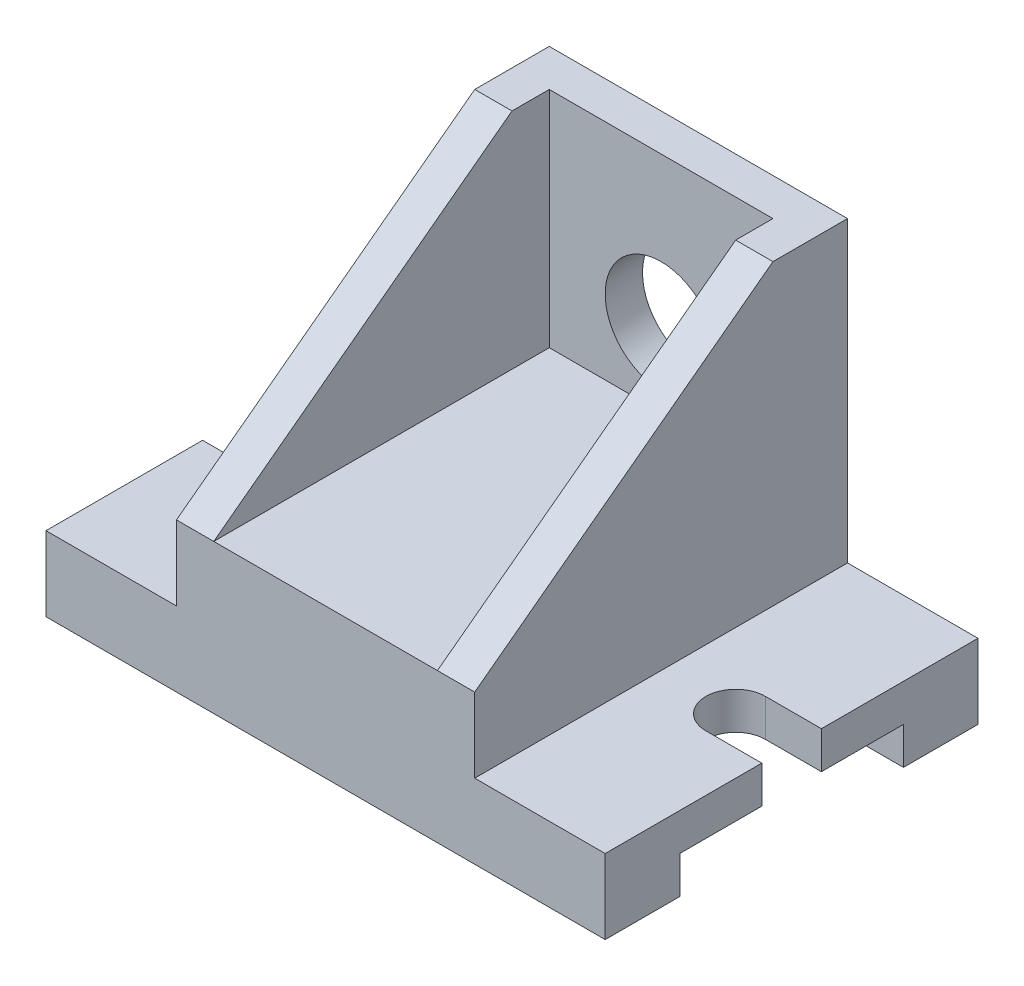
from build123d import *

# Parameters (mm, degrees)
BOSS_EXTRUDE1_DEPTH = 20
SKETCH2_W           = 60
SKETCH2_H           = 10
CUT_EXTRUDE1_DEPTH  = 182.383571472
SKETCH3_W           = 80
SKETCH3_H           = 100
BOSS_EXTRUDE2_DEPTH = 20
BOSS_EXTRUDE4_DEPTH = 60
CUT_EXTRUDE5_DEPTH  = 189.745860882
SKETCH12_R          = 15
CUT_EXTRUDE6_DEPTH  = 198.230829233
SKETCH13_W          = 60
SKETCH13_H          = 60
CUT_EXTRUDE7_DEPTH  = 10


with BuildPart() as part:
    # Sketch1 → Boss-Extrude1 (new body)
    with BuildSketch(Plane(origin=(0, 0, 0), x_dir=(1, 0, 0), z_dir=(0, 1, 0))):
        with BuildLine():
            Line((135, 58), (150, 58))
            Line((150, 58), (150, 100))
            Line((150, 100), (0, 100))
            Line((0, 100), (0, 58))
            Line((0, 58), (15, 58))
            ThreePointArc((15, 58), (23, 50), (15, 42))
            Line((15, 42), (0, 42))
            Line((0, 42), (0, 0))
            Line((0, 0), (150, 0))
            Line((150, 0), (150, 42))
            Line((150, 42), (135, 42))
            ThreePointArc((135, 42), (127, 50), (135, 58))
        make_face()
    extrude(amount=BOSS_EXTRUDE1_DEPTH)

    # Sketch2 → Cut-Extrude1 (cut, through all)
    with BuildSketch(Plane(origin=(150, 0, 0), x_dir=(0, 0, -1), z_dir=(1, 0, 0))):
        with Locations((50, 5)):
            Rectangle(SKETCH2_W, SKETCH2_H)
    extrude(amount=-CUT_EXTRUDE1_DEPTH, mode=Mode.SUBTRACT)

    # Sketch3 → Boss-Extrude2 (add)
    with BuildSketch(Plane(origin=(0, 20, 0), x_dir=(1, 0, 0), z_dir=(0, 1, 0))):
        with Locations((75, 50)):
            Rectangle(SKETCH3_W, SKETCH3_H)
    extrude(amount=BOSS_EXTRUDE2_DEPTH)

    # Sketch8 → Boss-Extrude4 (add)
    with BuildSketch(Plane(origin=(0, 40, 0), x_dir=(1, 0, 0), z_dir=(0, 1, 0))):
        Polygon((115, 100), (35, 100), (35, 0), (45, 0), (45, 80), (105, 80), (105, 0), (115, 0), align=None)
    extrude(amount=BOSS_EXTRUDE4_DEPTH)

    # Sketch11 → Cut-Extrude5 (cut, through all)
    with BuildSketch(Plane(origin=(125, 0, 0), x_dir=(0, 0, -1), z_dir=(1, 0, 0))):
        Polygon((0, 40), (80, 100), (0, 100), align=None)
    extrude(amount=-CUT_EXTRUDE5_DEPTH, mode=Mode.SUBTRACT)

    # Sketch12 → Cut-Extrude6 (cut, through all)
    with BuildSketch(Plane.XY.offset(-80)):
        with Locations((75, 60)):
            Circle(SKETCH12_R)
    extrude(amount=-CUT_EXTRUDE6_DEPTH, mode=Mode.SUBTRACT)

    # Sketch13 → Cut-Extrude7 (cut)
    with BuildSketch(Plane.XY.offset(-80)):
        with Locations((75, 70)):
            Rectangle(SKETCH13_W, SKETCH13_H)
    extrude(amount=-CUT_EXTRUDE7_DEPTH, mode=Mode.SUBTRACT)


solid = part.part
